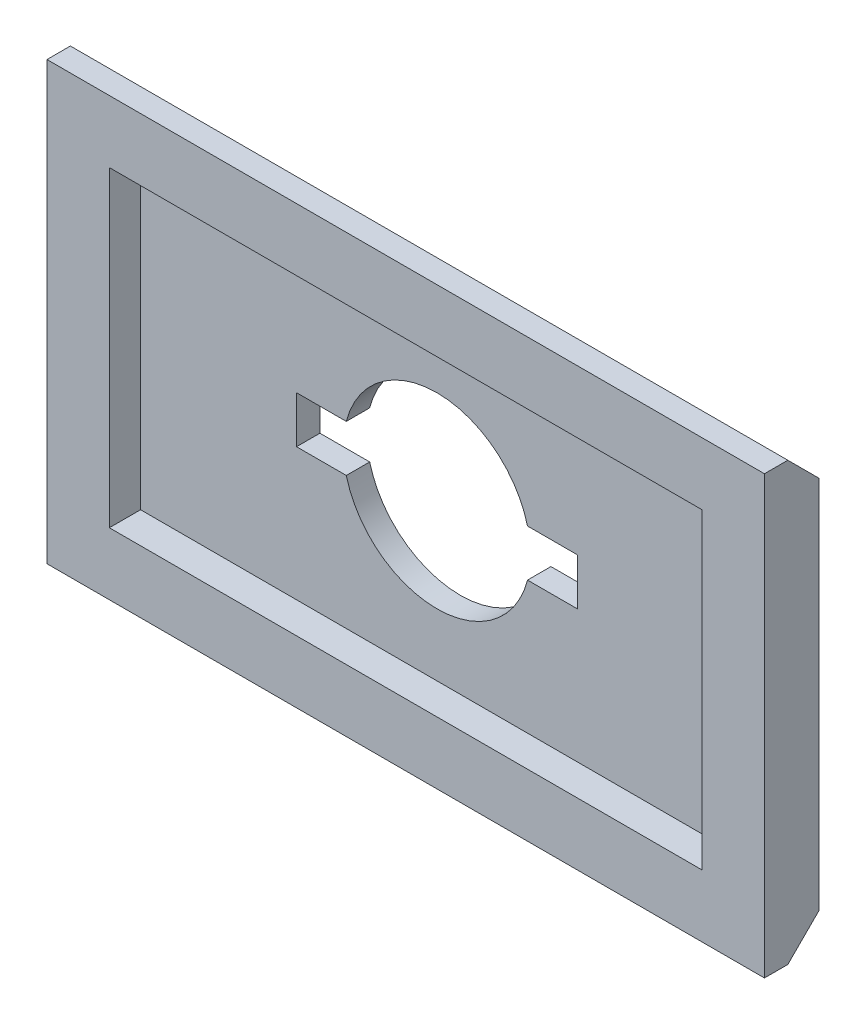
from build123d import *

# Parameters (mm, degrees)
SKETCH_1_W          = 46
SKETCH_1_H          = 28
EXTRUDE_1_DEPTH     = 3.5
SKETCH_2_W          = 38
SKETCH_2_H          = 20
CUT_EXTRUDE_1_DEPTH = 2
CHAMFER_1_SIZE      = 2


with BuildPart() as part:
    # 草图1 → 凸台-拉伸1 (new body)
    with BuildSketch(Plane.XY):
        Rectangle(SKETCH_1_W, SKETCH_1_H)
        with BuildLine():
            Line((5.809475019, 1.5), (9, 1.5))
            Line((9, 1.5), (9, -1.5))
            Line((9, -1.5), (5.809475019, -1.5))
            ThreePointArc((5.809475019, -1.5), (0, -6), (-5.809475019, -1.5))
            Line((-5.809475019, -1.5), (-9, -1.5))
            Line((-9, -1.5), (-9, 1.5))
            Line((-9, 1.5), (-5.809475019, 1.5))
            ThreePointArc((-5.809475019, 1.5), (0, 6), (5.809475019, 1.5))
        make_face(mode=Mode.SUBTRACT)
    extrude(amount=EXTRUDE_1_DEPTH)

    # 草图2 → 切除-拉伸1 (cut)
    with BuildSketch(Plane.XY.offset(3.5)):
        Rectangle(SKETCH_2_W, SKETCH_2_H)
    extrude(amount=-CUT_EXTRUDE_1_DEPTH, mode=Mode.SUBTRACT)

    # 倒角1
    chamfer_1_edges = [part.edges().sort_by_distance(p)[0] for p in [
        (0, -14, 0),
        (0, 14, 0),
    ]]
    chamfer(chamfer_1_edges, length=CHAMFER_1_SIZE)


solid = part.part
